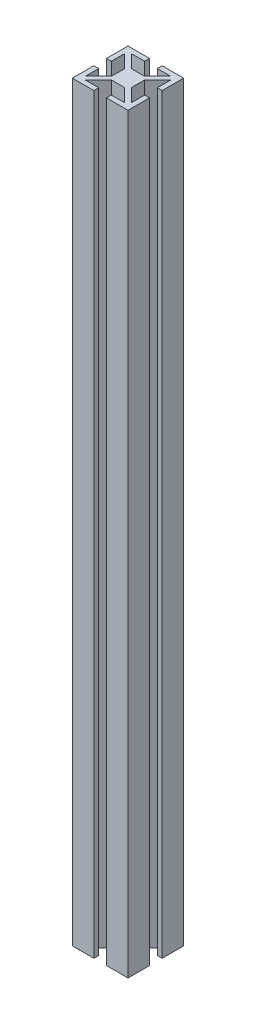
from build123d import *

# Parameters (mm, degrees)
BOSS_EXTRUDE1_DEPTH = 342.9


with BuildPart() as part:
    # Sketch1 → Boss-Extrude1 (new body)
    with BuildSketch(Plane(origin=(11.365010382, 0, 9.846206226), x_dir=(1, 0, 0), z_dir=(0, 1, 0))):
        Polygon((-24.065010382, 22.546206226), (-14.229795365, 22.546206226), (-14.229795365, 20.336406226), (-20.292645817, 20.336406226), (-14.310945817, 14.354706226), (-8.419074947, 14.354706226), (-2.437374947, 20.336406226), (-8.5002254, 20.336406226), (-8.5002254, 22.546206226), (1.334989618, 22.546206226), (1.334989618, 12.710991208), (-0.874810382, 12.710991208), (-0.874810382, 18.773841661), (-6.856510382, 12.792141661), (-6.856510382, 6.900270791), (-0.874810382, 0.918570791), (-0.874810382, 6.981421243), (1.334989618, 6.981421243), (1.334989618, -2.853793774), (-8.5002254, -2.853793774), (-8.5002254, -0.643993774), (-2.437374947, -0.643993774), (-8.419074947, 5.337706226), (-14.310945817, 5.337706226), (-20.292645817, -0.643993774), (-14.229795365, -0.643993774), (-14.229795365, -2.853793774), (-24.065010382, -2.853793774), (-24.065010382, 6.981421243), (-21.855210382, 6.981421243), (-21.855210382, 0.918570791), (-15.873510382, 6.900270791), (-15.873510382, 12.792141661), (-21.855210382, 18.773841661), (-21.855210382, 12.710991208), (-24.065010382, 12.710991208), align=None)
    extrude(amount=BOSS_EXTRUDE1_DEPTH)


solid = part.part
